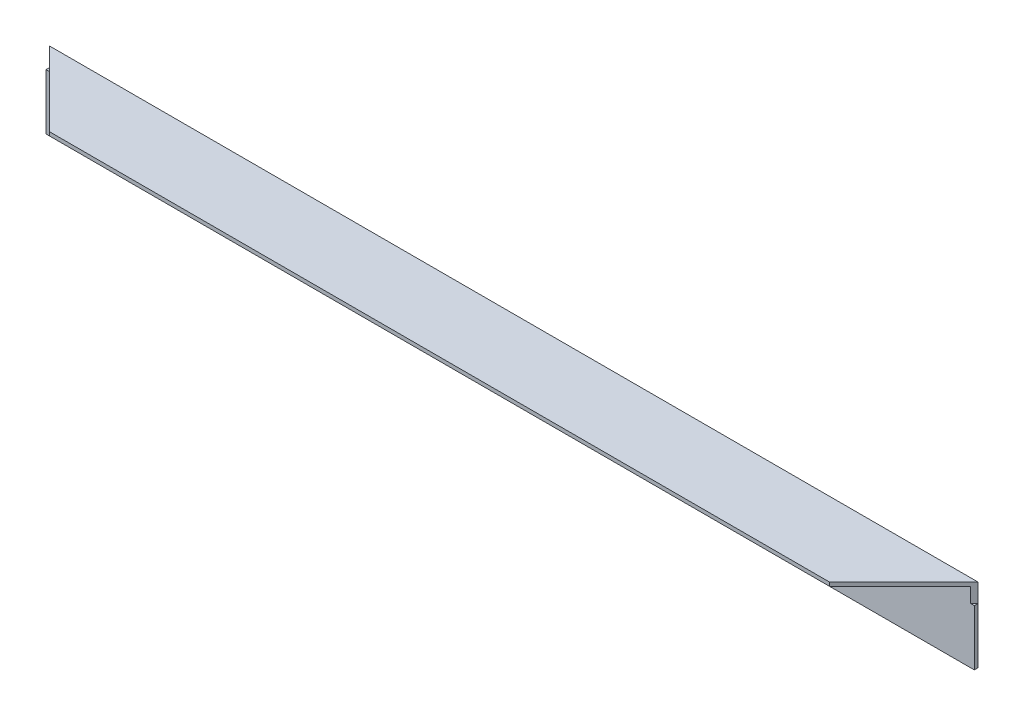
from build123d import *

# Parameters (mm, degrees)
SKETCH2_W           = 500
SKETCH2_H           = 40
BOSS_EXTRUDE1_DEPTH = 40
SKETCH3_W           = 38
SKETCH3_H           = 38
CUT_EXTRUDE1_DEPTH  = 500
CUT_EXTRUDE2_DEPTH  = 10


with BuildPart() as part:
    # Sketch2 → Boss-Extrude1 (new body)
    with BuildSketch(Plane.XY):
        with Locations((-79.545454545, 73.276515152)):
            Rectangle(SKETCH2_W, SKETCH2_H)
    extrude(amount=BOSS_EXTRUDE1_DEPTH)

    # Sketch3 → Cut-Extrude1 (cut)
    with BuildSketch(Plane.ZY.offset(329.545454545)):
        with Locations((21, 72.276515152)):
            Rectangle(SKETCH3_W, SKETCH3_H)
    extrude(amount=-CUT_EXTRUDE1_DEPTH, mode=Mode.SUBTRACT)

    # Sketch4 → Cut-Extrude2 (cut)
    with BuildSketch(Plane(origin=(0, 93.276515152, 0), x_dir=(1, 0, 0), z_dir=(0, 1, 0))):
        Polygon((-329.545454545, 0), (-329.545454545, -40), (-289.545454545, -40), align=None)
        Polygon((170.454545455, -40), (170.454545455, 0), (130.454545455, -40), align=None)
    extrude(amount=-CUT_EXTRUDE2_DEPTH, mode=Mode.SUBTRACT)


solid = part.part
